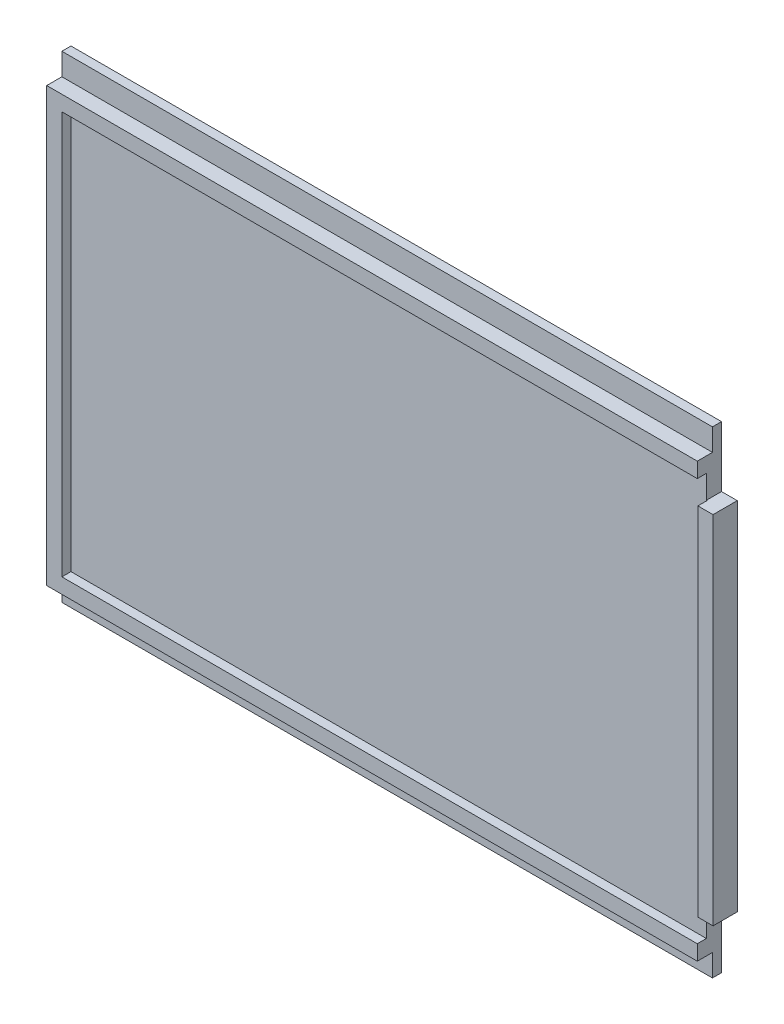
from build123d import *

# Parameters (mm, degrees)
CROQUIS1_W              = 220
CROQUIS1_H              = 143
SALIENTE_EXTRUIR1_DEPTH = 5
CROQUIS2_W              = 210
CROQUIS2_H              = 133
CORTAR_EXTRUIR1_DEPTH   = 3
CROQUIS3_W              = 220
CROQUIS3_H              = 157.6
SALIENTE_EXTRUIR2_DEPTH = 3
CROQUIS4_W              = 5.2
CROQUIS4_H              = 20
CORTAR_EXTRUIR2_DEPTH   = 136.548662848


with BuildPart() as part:
    # Croquis1 → Saliente-Extruir1 (new body)
    with BuildSketch(Plane.XY):
        Rectangle(CROQUIS1_W, CROQUIS1_H)
    extrude(amount=SALIENTE_EXTRUIR1_DEPTH)

    # Croquis2 → Cortar-Extruir1 (cut)
    with BuildSketch(Plane.XY.offset(5)):
        Rectangle(CROQUIS2_W, CROQUIS2_H)
    extrude(amount=-CORTAR_EXTRUIR1_DEPTH, mode=Mode.SUBTRACT)

    # Croquis3 → Saliente-Extruir2 (add)
    with BuildSketch(Plane(origin=(0, 0, 0), x_dir=(-1, 0, 0), z_dir=(0, 0, -1))):
        Rectangle(CROQUIS3_W, CROQUIS3_H)
    extrude(amount=SALIENTE_EXTRUIR2_DEPTH)

    # Croquis4 → Cortar-Extruir2 (cut, through all)
    with BuildSketch(Plane(origin=(0, 0, -3), x_dir=(-1, 0, 0), z_dir=(0, 0, -1))):
        with Locations((-107.4, 68.8)):
            Rectangle(CROQUIS4_W, CROQUIS4_H)
        with Locations((-107.4, -68.8)):
            Rectangle(CROQUIS4_W, CROQUIS4_H)
    extrude(amount=-CORTAR_EXTRUIR2_DEPTH, mode=Mode.SUBTRACT)


solid = part.part
